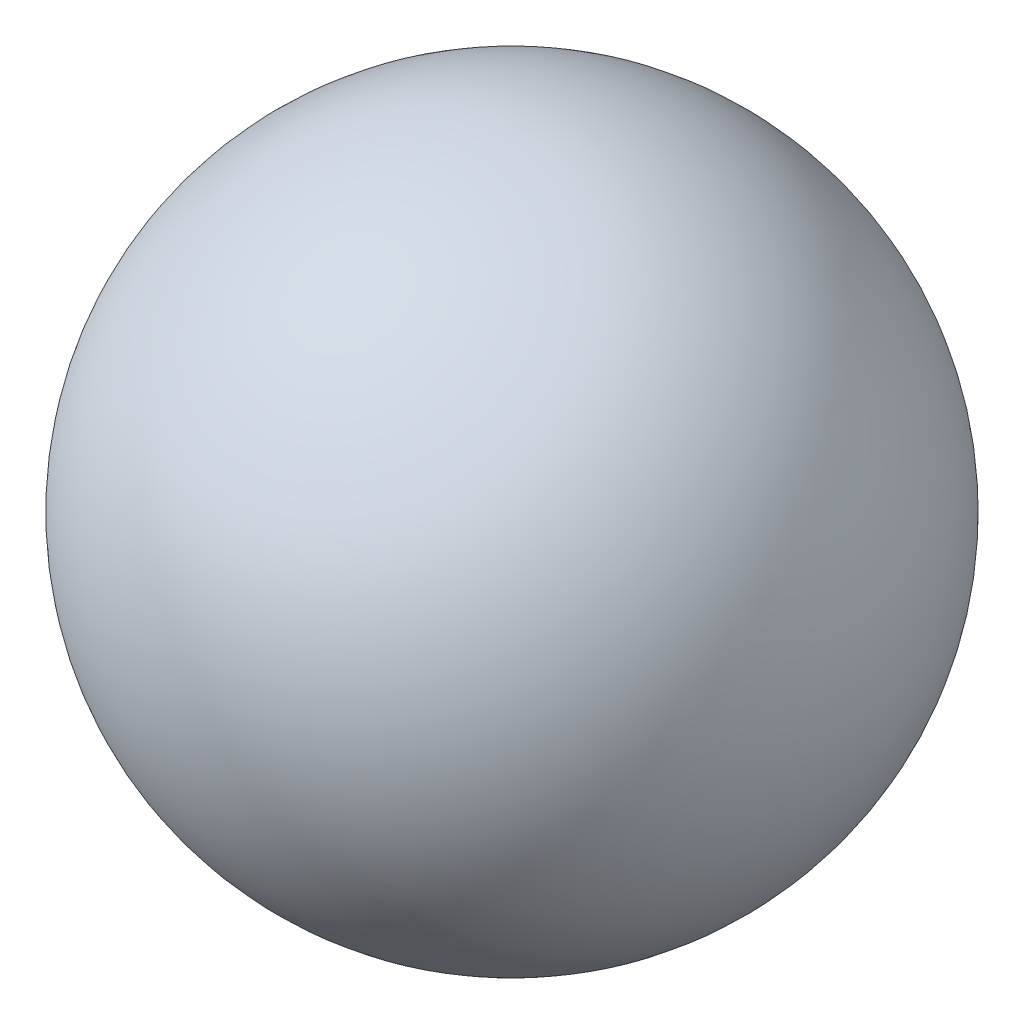
from build123d import *


with BuildPart() as part:
    # Sketch1 → Revolve1 (revolve)
    with BuildSketch(Plane.XY):
        with BuildLine():
            Line((0, -25.4), (0, 25.4))
            ThreePointArc((0, 25.4), (25.4, 0), (0, -25.4))
        make_face()
    revolve(axis=Axis((0, -25.4, 0), (0, 1, 0)))


solid = part.part
